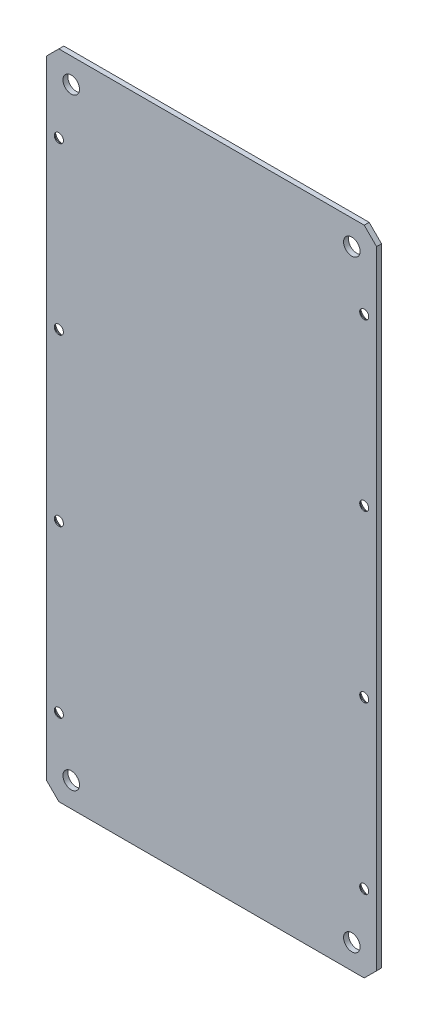
from build123d import *

# Parameters (mm, degrees)
SKETCH_1_R      = 5
SKETCH_1_R_2    = 2.75
EXTRUDE_1_DEPTH = 3
CHAMFER_1_SIZE  = 2.5


with BuildPart() as part:
    # Эскиз1 → Вытянуть1 (new body)
    with BuildSketch(Plane.XY):
        Polygon((-100, 190), (-92.5, 197.5), (92.5, 197.5), (100, 190), (100, -190), (92.5, -197.5), (-92.5, -197.5), (-100, -190), align=None)
        with Locations((-85, 182.5)):
            Circle(SKETCH_1_R, mode=Mode.SUBTRACT)
        with Locations(Location((85, 182.5, 0), (0, 0, 180))):
            Circle(SKETCH_1_R, mode=Mode.SUBTRACT)
        with Locations((85, -182.5)):
            Circle(SKETCH_1_R, mode=Mode.SUBTRACT)
        with Locations(Location((-85, -182.5, 0), (0, 0, 180))):
            Circle(SKETCH_1_R, mode=Mode.SUBTRACT)
        with Locations((-92.5, 150.75)):
            Circle(SKETCH_1_R_2, mode=Mode.SUBTRACT)
        with Locations(Location((-92.5, -150.75, 0), (0, 0, 180))):
            Circle(SKETCH_1_R_2, mode=Mode.SUBTRACT)
        with Locations((-92.5, 50.25)):
            Circle(SKETCH_1_R_2, mode=Mode.SUBTRACT)
        with Locations(Location((-92.5, -50.25, 0), (0, 0, 180))):
            Circle(SKETCH_1_R_2, mode=Mode.SUBTRACT)
        with Locations(Location((92.5, 150.75, 0), (0, 0, 180))):
            Circle(SKETCH_1_R_2, mode=Mode.SUBTRACT)
        with Locations(Location((92.5, 50.25, 0), (0, 0, 180))):
            Circle(SKETCH_1_R_2, mode=Mode.SUBTRACT)
        with Locations((92.5, -50.25)):
            Circle(SKETCH_1_R_2, mode=Mode.SUBTRACT)
        with Locations((92.5, -150.75)):
            Circle(SKETCH_1_R_2, mode=Mode.SUBTRACT)
    extrude(amount=EXTRUDE_1_DEPTH)

    # Фаска1
    chamfer_1_edges = [part.edges().sort_by_distance(p)[0] for p in [
        (-95.25, 150.75, 0),
        (-89.75, -150.75, 0),
        (-95.25, 50.25, 0),
        (-89.75, -50.25, 0),
        (95.25, 150.75, 0),
        (95.25, 50.25, 0),
        (89.75, -50.25, 0),
        (89.75, -150.75, 0),
    ]]
    chamfer(chamfer_1_edges, length=CHAMFER_1_SIZE)


solid = part.part
